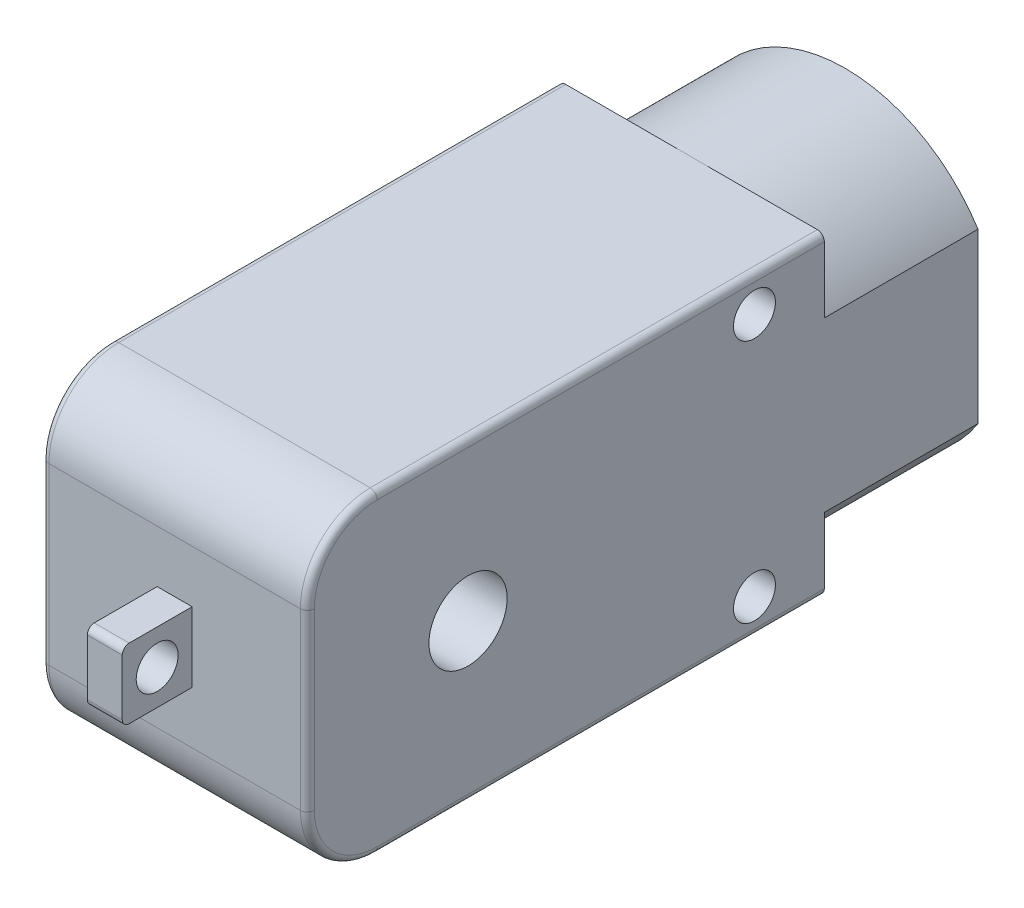
from build123d import *

# Parameters (mm, degrees)
SKETCH1_W           = 19
SKETCH1_H           = 22.5
BOSS_EXTRUDE1_DEPTH = 37
BOSS_EXTRUDE2_DEPTH = 11
FILLET1_R           = 5
SKETCH3_R           = 1.5
CUT_EXTRUDE1_DEPTH  = 44.087846314
SKETCH4_W           = 2.5
SKETCH4_H           = 5
BOSS_EXTRUDE3_DEPTH = 5
FILLET2_R           = 0.5
SKETCH5_R           = 1.5
CUT_EXTRUDE2_DEPTH  = 5
SKETCH6_R           = 2.8
CUT_EXTRUDE3_DEPTH  = 48.450632264
CUT_EXTRUDE4_DEPTH  = 11
SKETCH8_R           = 3
CUT_EXTRUDE5_DEPTH  = 2


with BuildPart() as part:
    # Sketch1 → Boss-Extrude1 (new body)
    with BuildSketch(Plane.XY):
        Rectangle(SKETCH1_W, SKETCH1_H)
    extrude(amount=BOSS_EXTRUDE1_DEPTH)

    # Sketch2 → Boss-Extrude2 (add)
    with BuildSketch(Plane(origin=(0, 0, 0), x_dir=(-1, 0, 0), z_dir=(0, 0, -1))):
        with BuildLine():
            Line((9.5, 6.025985397), (9.5, -6.025985397))
            ThreePointArc((9.5, -6.025985397), (0, -11.25), (-9.5, -6.025985397))
            Line((-9.5, -6.025985397), (-9.5, 6.025985397))
            ThreePointArc((-9.5, 6.025985397), (0, 11.25), (9.5, 6.025985397))
        make_face()
    extrude(amount=BOSS_EXTRUDE2_DEPTH)

    # Fillet1
    fillet1_edges = [part.edges().sort_by_distance(p)[0] for p in [
        (0, 11.25, 37),
        (0, -11.25, 37),
    ]]
    fillet(fillet1_edges, radius=FILLET1_R)

    # Sketch3 → Cut-Extrude1 (cut, through all)
    with BuildSketch(Plane(origin=(9.5, 0, 0), x_dir=(0, 0, -1), z_dir=(1, 0, 0))):
        with Locations(Location((-5, 8.75, 0), (0, 0, 90))):
            Circle(SKETCH3_R)
        with Locations(Location((-5, -8.75, 0), (0, 0, 90))):
            Circle(SKETCH3_R)
    extrude(amount=-CUT_EXTRUDE1_DEPTH, mode=Mode.SUBTRACT)

    # Sketch4 → Boss-Extrude3 (add)
    with BuildSketch(Plane.XY.offset(37)):
        Rectangle(SKETCH4_W, SKETCH4_H)
    extrude(amount=BOSS_EXTRUDE3_DEPTH)

    # Fillet2
    fillet2_edges = [part.edges().sort_by_distance(p)[0] for p in [
        (-9.5, 0, 37),
        (9.5, 0, 37),
        (9.5, 11.25, 16),
        (9.5, -11.25, 16),
        (9.5, 9.785533906, 35.535533906),
        (9.5, -9.785533906, 35.535533906),
        (-9.5, -11.25, 16),
        (-9.5, 11.25, 16),
        (-9.5, 9.785533906, 35.535533906),
        (-9.5, -9.785533906, 35.535533906),
        (0, -2.5, 42),
        (0, 2.5, 42),
    ]]
    fillet(fillet2_edges, radius=FILLET2_R)

    # Sketch5 → Cut-Extrude2 (cut)
    with BuildSketch(Plane(origin=(1.25, 0, 0), x_dir=(0, 0, -1), z_dir=(1, 0, 0))):
        with Locations(Location((-39.5, 0, 0), (0, 0, 90))):
            Circle(SKETCH5_R)
    extrude(amount=-CUT_EXTRUDE2_DEPTH, mode=Mode.SUBTRACT)

    # Sketch6 → Cut-Extrude3 (cut, through all)
    with BuildSketch(Plane(origin=(9.5, 0, 0), x_dir=(0, 0, -1), z_dir=(1, 0, 0))):
        with Locations(Location((-25.5, 0, 0), (0, 0, 90))):
            Circle(SKETCH6_R)
    extrude(amount=-CUT_EXTRUDE3_DEPTH, mode=Mode.SUBTRACT)

    # Sketch7 → Cut-Extrude4 (cut)
    with BuildSketch(Plane(origin=(0, 0, -11), x_dir=(-1, 0, 0), z_dir=(0, 0, -1))):
        with BuildLine():
            Line((-8.3, 5.666789214), (-8.3, -5.666789214))
            ThreePointArc((-8.3, -5.666789214), (0, -10.05), (8.3, -5.666789214))
            Line((8.3, -5.666789214), (8.3, 5.666789214))
            ThreePointArc((8.3, 5.666789214), (0, 10.05), (-8.3, 5.666789214))
        make_face()
    extrude(amount=-CUT_EXTRUDE4_DEPTH, mode=Mode.SUBTRACT)

    # Sketch8 → Cut-Extrude5 (cut)
    with BuildSketch(Plane(origin=(0, 0, 0), x_dir=(-1, 0, 0), z_dir=(0, 0, -1))):
        Circle(SKETCH8_R)
    extrude(amount=-CUT_EXTRUDE5_DEPTH, mode=Mode.SUBTRACT)


solid = part.part
